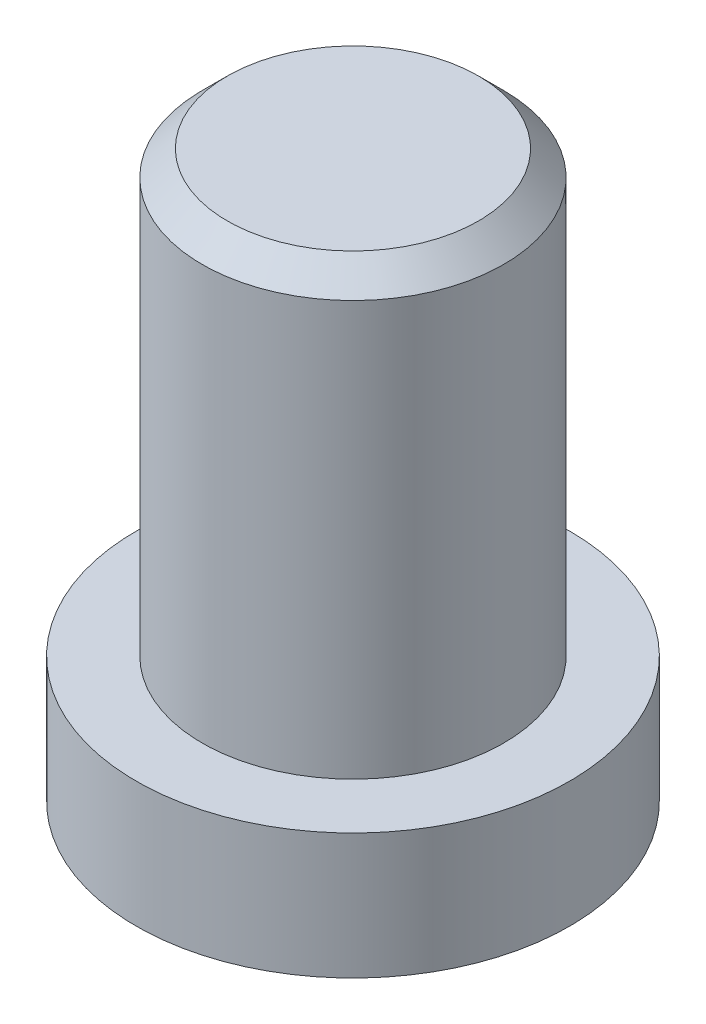
from build123d import *

# Parameters (mm, degrees)
SKETCH2_R           = 1.2
BOSS_EXTRUDE1_DEPTH = 4.5
SKETCH5_R           = 1.725
BOSS_EXTRUDE2_DEPTH = 1
CHAMFER1_SIZE       = 0.2


with BuildPart() as part:
    # Sketch2 → Boss-Extrude1 (new body)
    with BuildSketch(Plane(origin=(0, 0, 0), x_dir=(1, 0, 0), z_dir=(0, 1, 0))):
        with Locations(Location((0, 0, 0), (0, 0, 270))):
            Circle(SKETCH2_R)
    extrude(amount=BOSS_EXTRUDE1_DEPTH)

    # Sketch5 → Boss-Extrude2 (add)
    with BuildSketch(Plane.XZ):
        with Locations(Location((0, 0, 0), (0, 0, 270))):
            Circle(SKETCH5_R)
    extrude(amount=-BOSS_EXTRUDE2_DEPTH)

    # Chamfer1
    chamfer1_edges = [part.edges().sort_by_distance(p)[0] for p in [
        (0, 4.5, -1.2),
    ]]
    chamfer(chamfer1_edges, length=CHAMFER1_SIZE)


solid = part.part
